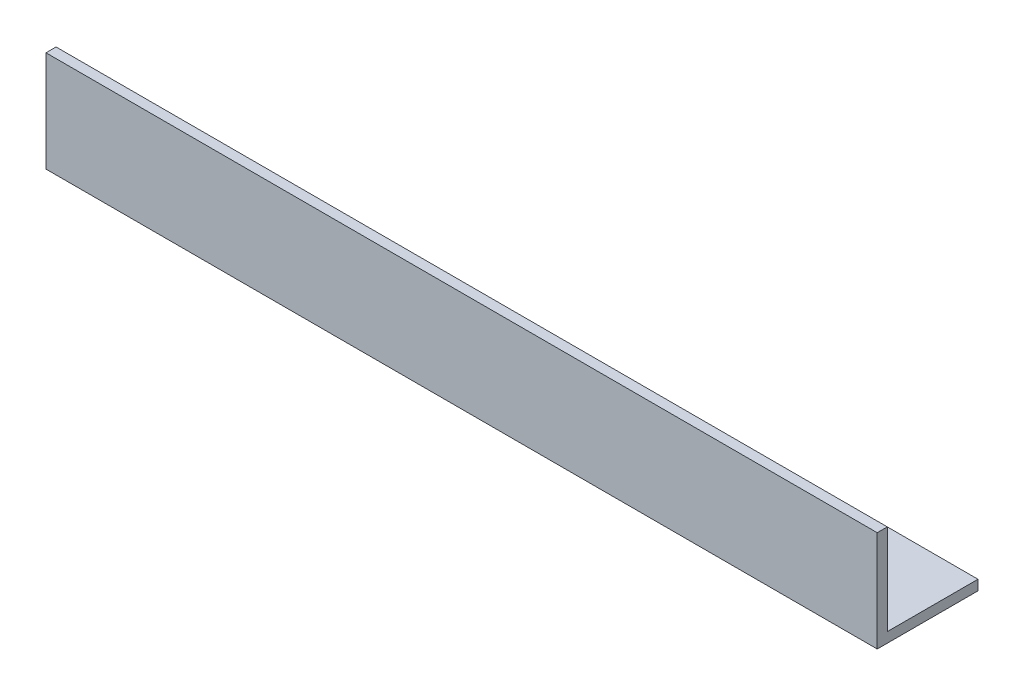
from build123d import *

# Parameters (mm, degrees)
BOSS_EXTRUDE1_DEPTH = 165


with BuildPart() as part:
    # Sketch1 → Boss-Extrude1 (new body)
    with BuildSketch(Plane(origin=(0, 0, 0), x_dir=(0, 0, -1), z_dir=(1, 0, 0))):
        Polygon((0, 20), (0, 0), (20, 0), (20, 2), (2, 2), (2, 20), align=None)
    extrude(amount=BOSS_EXTRUDE1_DEPTH)


solid = part.part
